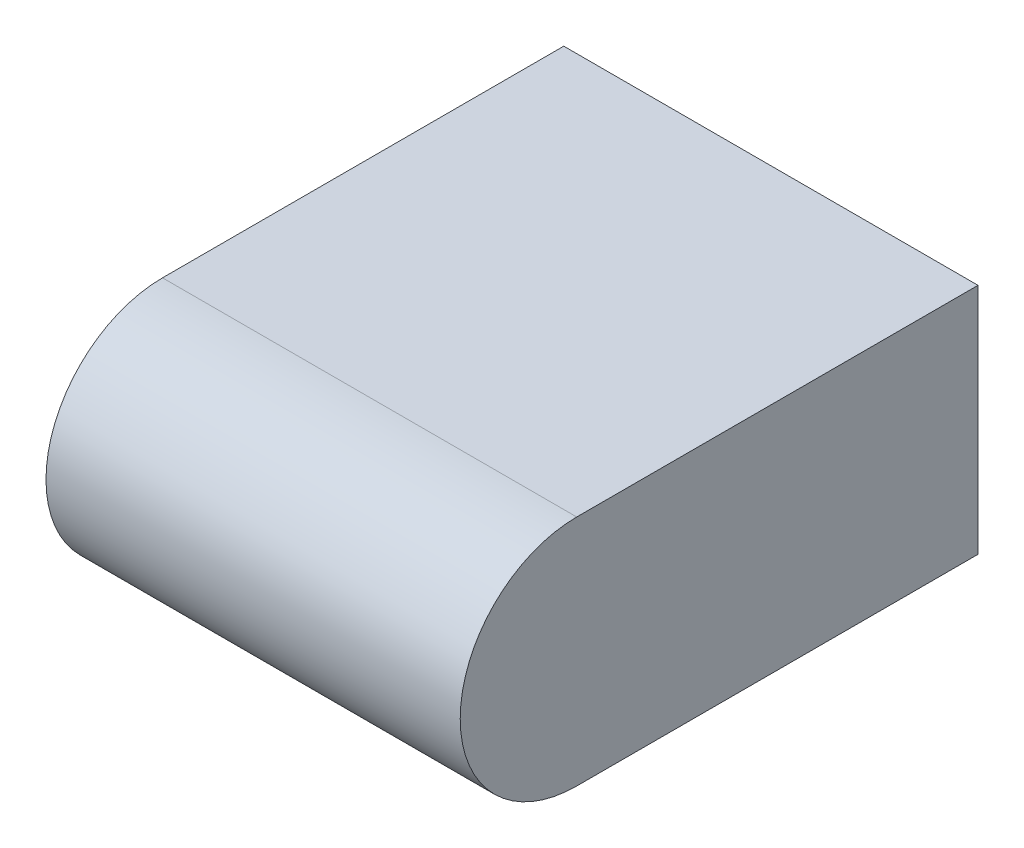
from build123d import *

# Parameters (mm, degrees)
IZIM1_W                     = 32
IZIM1_H                     = 40
Y_KSEKLIK_EKSTR_ZYON1_DEPTH = 18
RADYUS1_RADIUS              = 9
RADYUS1_LENGTH              = 32


with BuildPart() as part:
    # Çizim1 → Yükseklik-Ekstrüzyon1 (new body)
    with BuildSketch(Plane(origin=(0, 0, 0), x_dir=(1, 0, 0), z_dir=(0, 1, 0))):
        Rectangle(IZIM1_W, IZIM1_H)
    extrude(amount=Y_KSEKLIK_EKSTR_ZYON1_DEPTH)

    # Radyus1: full round fillet: the end face becomes a half cylinder, R = half its width
    radyus1_face = Plane((0, 9, 20), x_dir=(-1, 0, 0), z_dir=(0, 0, 1))  # on the end face: x along it, z out of the body
    radyus1_slab = radyus1_face.offset(-RADYUS1_RADIUS / 2) * Box(RADYUS1_LENGTH, 2 * RADYUS1_RADIUS, RADYUS1_RADIUS, mode=Mode.PRIVATE)  # the body's end, R deep
    radyus1_round = Plane((0, 9, 11), x_dir=(0, 0, 1), z_dir=(-1, 0, 0)) * Cylinder(RADYUS1_RADIUS, RADYUS1_LENGTH, mode=Mode.PRIVATE)  # its axis R under the face
    add(radyus1_slab - radyus1_round, mode=Mode.SUBTRACT)


solid = part.part
